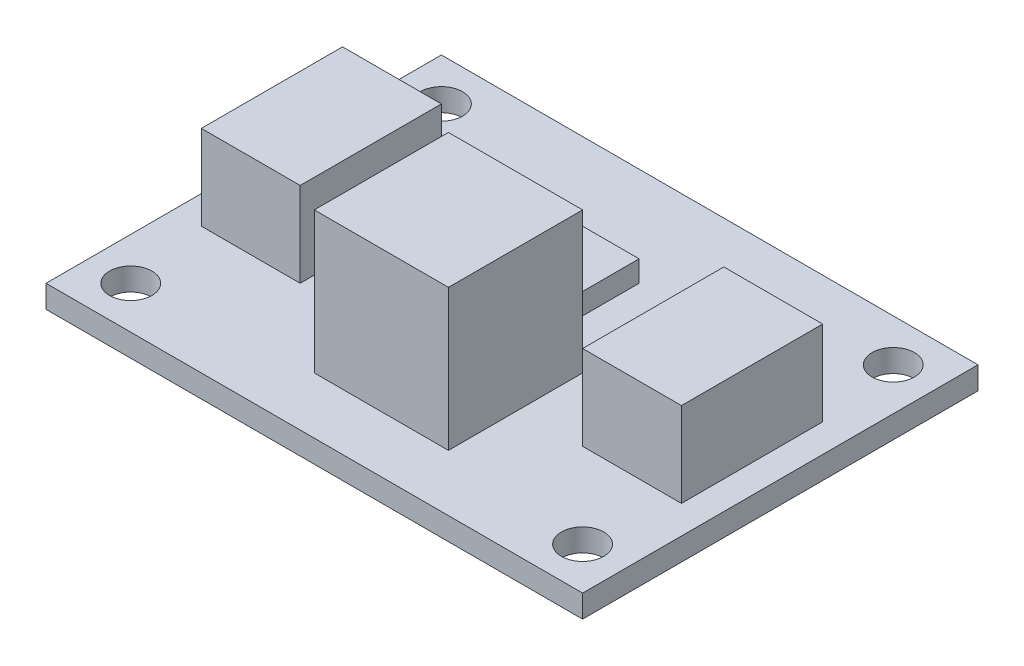
from build123d import *

# Parameters (mm, degrees)
SKETCH1_W               = 38
SKETCH1_H               = 28
PCB_DEPTH               = 1.6
MOUNT_HOLE_1_DEPTH      = 48.22880477
MOUNT_HOLE_1_DEPTH_BACK = 48.22880477
SKETCH2_R               = 1.5
MOUNT_HOLE_2_DEPTH      = 48.22880477
MOUNT_HOLE_2_DEPTH_BACK = 48.22880477
SKETCH3_R               = 1.5
MOUNT_HOLE_3_DEPTH      = 48.22880477
MOUNT_HOLE_3_DEPTH_BACK = 48.22880477
SKETCH4_R               = 1.5
MOUNT_HOLE_4_DEPTH      = 48.22880477
MOUNT_HOLE_4_DEPTH_BACK = 48.22880477
SKETCH5_R               = 1.5
SENSOR_CONNECTOR_START  = 1.6
SKETCH6_W               = 7
SKETCH6_H               = 10
SENSOR_CONNECTOR_DEPTH  = 6
SIGNAL_CONNECTOR_START  = 1.6
SKETCH7_W               = 7
SKETCH7_H               = 10
SIGNAL_CONNECTOR_DEPTH  = 6
THRESHOLD_POT_START     = 1.6
SKETCH8_W               = 9.5
SKETCH8_H               = 9.5
THRESHOLD_POT_DEPTH     = 10
COMPARATOR_START        = 1.6
SKETCH9_W               = 5
SKETCH9_H               = 4
COMPARATOR_DEPTH        = 1.5


with BuildPart() as part:
    # Sketch1 → PCB (new body)
    with BuildSketch(Plane(origin=(0, 0, 0), x_dir=(1, 0, 0), z_dir=(0, 1, 0))):
        with Locations((19, 14)):
            Rectangle(SKETCH1_W, SKETCH1_H)
    extrude(amount=PCB_DEPTH)

    # Sketch2 → Mount_hole_1 (cut, two sides: drawn at the far end of the back side and taken through both)
    with BuildSketch(Plane(origin=(0, 0, 0), x_dir=(1, 0, 0), z_dir=(0, 1, 0)).offset(-MOUNT_HOLE_1_DEPTH_BACK)):
        with Locations(Location((3, 3, 0), (0, 0, 270))):
            Circle(SKETCH2_R)
    extrude(amount=MOUNT_HOLE_1_DEPTH + MOUNT_HOLE_1_DEPTH_BACK, mode=Mode.SUBTRACT)

    # Sketch3 → Mount_hole_2 (cut, two sides: drawn at the far end of the back side and taken through both)
    with BuildSketch(Plane(origin=(0, 0, 0), x_dir=(1, 0, 0), z_dir=(0, 1, 0)).offset(-MOUNT_HOLE_2_DEPTH_BACK)):
        with Locations(Location((35, 3, 0), (0, 0, 270))):
            Circle(SKETCH3_R)
    extrude(amount=MOUNT_HOLE_2_DEPTH + MOUNT_HOLE_2_DEPTH_BACK, mode=Mode.SUBTRACT)

    # Sketch4 → Mount_hole_3 (cut, two sides: drawn at the far end of the back side and taken through both)
    with BuildSketch(Plane(origin=(0, 0, 0), x_dir=(1, 0, 0), z_dir=(0, 1, 0)).offset(-MOUNT_HOLE_3_DEPTH_BACK)):
        with Locations(Location((3, 25, 0), (0, 0, 270))):
            Circle(SKETCH4_R)
    extrude(amount=MOUNT_HOLE_3_DEPTH + MOUNT_HOLE_3_DEPTH_BACK, mode=Mode.SUBTRACT)

    # Sketch5 → Mount_hole_4 (cut, two sides: drawn at the far end of the back side and taken through both)
    with BuildSketch(Plane(origin=(0, 0, 0), x_dir=(1, 0, 0), z_dir=(0, 1, 0)).offset(-MOUNT_HOLE_4_DEPTH_BACK)):
        with Locations(Location((35, 25, 0), (0, 0, 270))):
            Circle(SKETCH5_R)
    extrude(amount=MOUNT_HOLE_4_DEPTH + MOUNT_HOLE_4_DEPTH_BACK, mode=Mode.SUBTRACT)

    # Sketch6 → Sensor_connector (add)
    with BuildSketch(Plane(origin=(0, 0, 0), x_dir=(1, 0, 0), z_dir=(0, 1, 0)).offset(SENSOR_CONNECTOR_START)):
        with Locations((5.5, 14)):
            Rectangle(SKETCH6_W, SKETCH6_H)
    extrude(amount=SENSOR_CONNECTOR_DEPTH)

    # Sketch7 → Signal_connector (add)
    with BuildSketch(Plane(origin=(0, 0, 0), x_dir=(1, 0, 0), z_dir=(0, 1, 0)).offset(SIGNAL_CONNECTOR_START)):
        with Locations((32.5, 14)):
            Rectangle(SKETCH7_W, SKETCH7_H)
    extrude(amount=SIGNAL_CONNECTOR_DEPTH)

    # Sketch8 → Threshold_pot (add)
    with BuildSketch(Plane(origin=(0, 0, 0), x_dir=(1, 0, 0), z_dir=(0, 1, 0)).offset(THRESHOLD_POT_START)):
        with Locations((19.75, 8.75)):
            Rectangle(SKETCH8_W, SKETCH8_H)
    extrude(amount=THRESHOLD_POT_DEPTH)

    # Sketch9 → Comparator (add)
    with BuildSketch(Plane(origin=(0, 0, 0), x_dir=(1, 0, 0), z_dir=(0, 1, 0)).offset(COMPARATOR_START)):
        with Locations((18.5, 19)):
            Rectangle(SKETCH9_W, SKETCH9_H)
    extrude(amount=COMPARATOR_DEPTH)


solid = part.part
